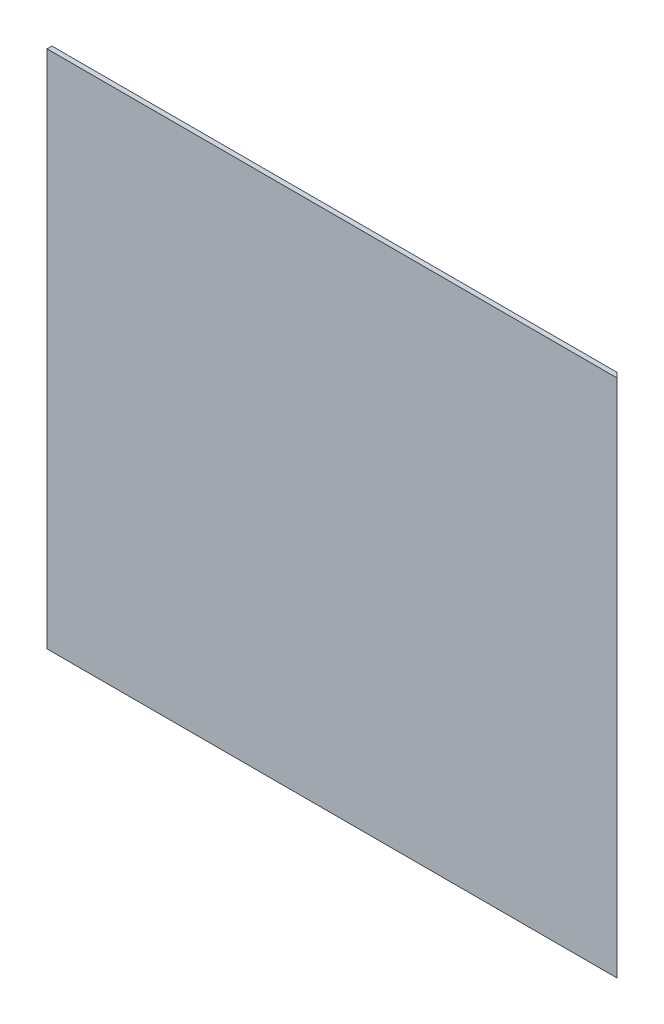
from build123d import *

# Parameters (mm, degrees)
SKETCH_1_W          = 351
SKETCH_1_H          = 320
EXTRUDE_1_DEPTH     = 3
CUT_EXTRUDE_1_DEPTH = 365.97842402


with BuildPart() as part:
    # 草图1 → 凸台-拉伸1 (new body)
    with BuildSketch(Plane.XY):
        Rectangle(SKETCH_1_W, SKETCH_1_H)
    extrude(amount=EXTRUDE_1_DEPTH)

    # 草图2 → 切除-拉伸1 (cut, through all)
    with BuildSketch(Plane(origin=(0, 160, 0), x_dir=(1, 0, 0), z_dir=(0, 1, 0))):
        Polygon((175.5, -3), (172.5, 0), (175.5, 0), align=None)
    extrude(amount=-CUT_EXTRUDE_1_DEPTH, mode=Mode.SUBTRACT)


solid = part.part
